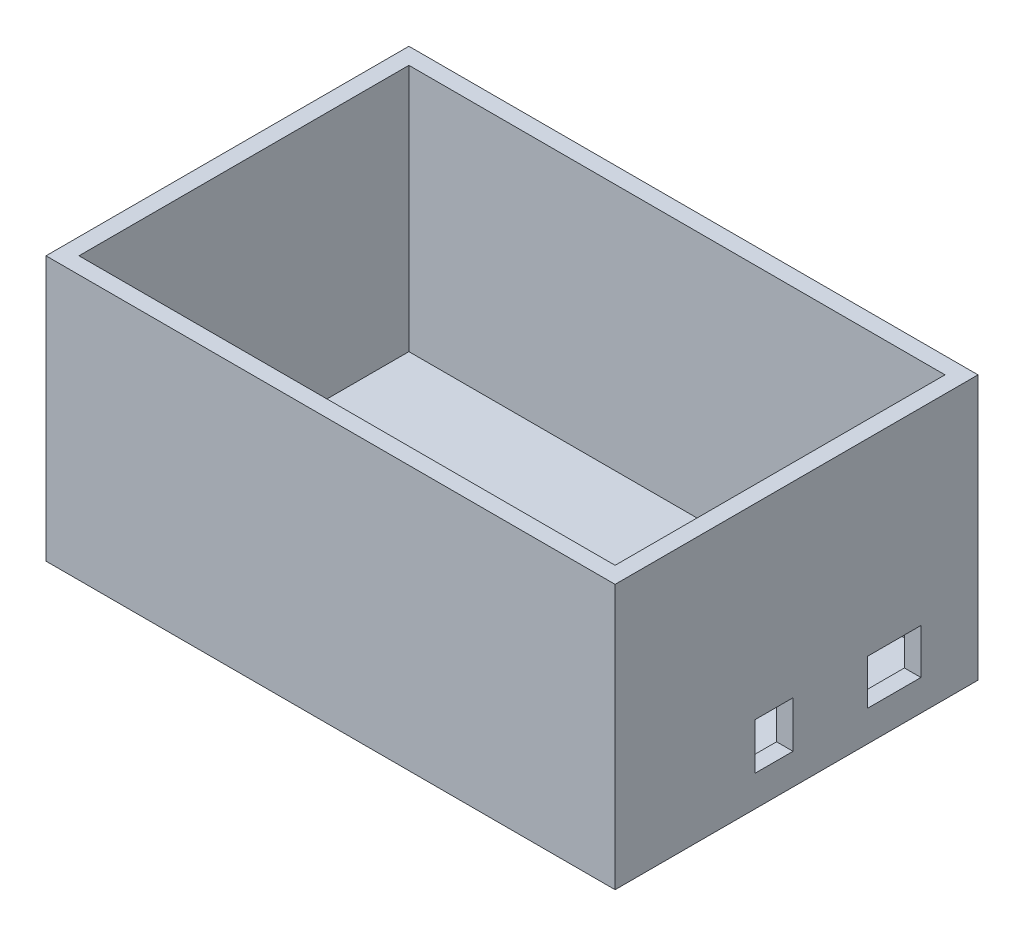
from build123d import *

# Parameters (mm, degrees)
BOSS_EXTRUDE1_DEPTH      = 40
BOSS_EXTRUDE1_DEPTH_BACK = 24.13
SKETCH1_W                = 138
SKETCH1_H                = 88
SHELL1_T                 = -4
SKETCH10_W               = 12.954
SKETCH10_H               = 10.922
CUT_EXTRUDE1_DEPTH       = 4
SKETCH12_W               = 9.254
SKETCH12_H               = 11.254
CUT_EXTRUDE2_DEPTH       = 4


with BuildPart() as part:
    # Sketch1 → Boss-Extrude1 (new, two sides: drawn at the far end of the back side and taken through both)
    with BuildSketch(Plane(origin=(0, 0, 0), x_dir=(1, 0, 0), z_dir=(0, 1, 0)).offset(-BOSS_EXTRUDE1_DEPTH_BACK)):
        with Locations((29.3125, -12.885)):
            Rectangle(SKETCH1_W, SKETCH1_H)
    extrude(amount=BOSS_EXTRUDE1_DEPTH + BOSS_EXTRUDE1_DEPTH_BACK)

    # Shell1
    shell1_openings = [part.faces().sort_by_distance(p)[0] for p in [
        (29.3125, 40, 12.885),
    ]]
    offset(amount=SHELL1_T, openings=shell1_openings, kind=Kind.INTERSECTION)

    # Sketch10 → Cut-Extrude1 (cut)
    with BuildSketch(Plane.ZY.offset(-98.3125)):
        with Locations((-10.795, -11.176)):
            Rectangle(SKETCH10_W, SKETCH10_H)
    extrude(amount=CUT_EXTRUDE1_DEPTH, mode=Mode.SUBTRACT)

    # Sketch12 → Cut-Extrude2 (cut)
    with BuildSketch(Plane.ZY.offset(-98.3125)):
        with Locations((18.36, -11.01)):
            Rectangle(SKETCH12_W, SKETCH12_H)
    extrude(amount=CUT_EXTRUDE2_DEPTH, mode=Mode.SUBTRACT)


solid = part.part
